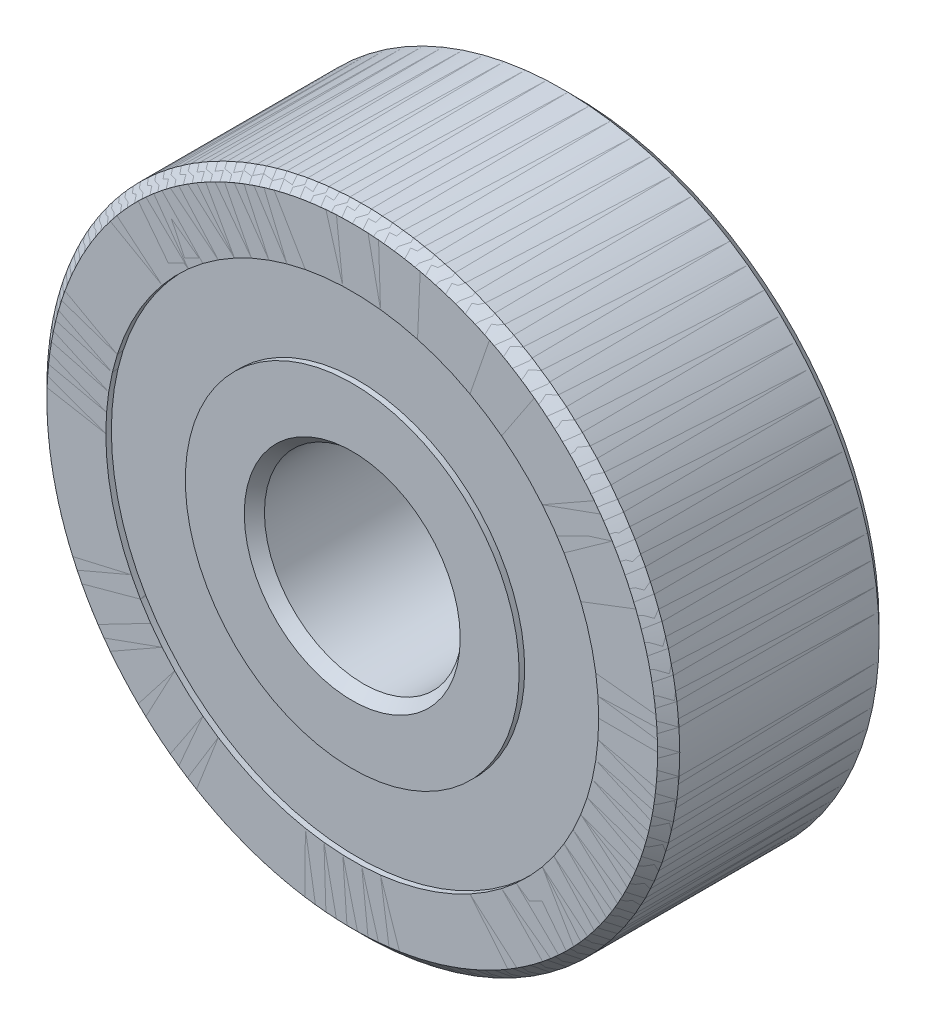
from build123d import *

# Parameters (mm, degrees)
CHAMFER1_SIZE     = 0.14
CIRPATTERN1_COUNT = 7
SKETCH5_W         = 0.705
SKETCH5_H         = 1.005


with BuildPart() as part:
    # Sketch8 → Revolve1 (revolve)
    with BuildSketch(Plane(origin=(0, 0, 0), x_dir=(0, 0, -1), z_dir=(1, 0, 0))):
        with BuildLine():
            Line((1.4, 4), (-1.4, 4))
            Line((-1.4, 4), (-1.4, 3.115))
            Line((-1.4, 3.115), (-0.37164331, 3.115))
            ThreePointArc((-0.37164331, 3.115), (0, 3.2375), (0.37164331, 3.115))
            Line((0.37164331, 3.115), (1.4, 3.115))
            Line((1.4, 3.115), (1.4, 4))
        make_face()
    revolve(axis=Axis((0, 0, 1.4), (0, 0, -1)))

    # Chamfer1
    chamfer1_edges = [part.edges().sort_by_distance(p)[0] for p in [
        (0, -4, -1.4),
        (0, -4, 1.4),
    ]]
    chamfer(chamfer1_edges, length=CHAMFER1_SIZE)


with BuildPart() as body_2:
    # Sketch2 → Revolve2 (revolve)
    with BuildSketch(Plane(origin=(0, 0, 0), x_dir=(0, 0, -1), z_dir=(1, 0, 0))):
        with BuildLine():
            Line((-0.37164331, 3.115), (-1.4, 3.115))
            Line((-1.4, 3.115), (-1.4, 3.86))
            Line((-1.4, 3.86), (-1.26, 4))
            Line((-1.26, 4), (1.26, 4))
            Line((1.26, 4), (1.4, 3.86))
            Line((1.4, 3.86), (1.4, 3.115))
            Line((1.4, 3.115), (0.37164331, 3.115))
            ThreePointArc((0.37164331, 3.115), (0, 3.2375), (-0.37164331, 3.115))
        make_face()
        with BuildLine():
            Line((1.4, 2.11), (0.37164331, 2.11))
            ThreePointArc((0.37164331, 2.11), (0, 1.9875), (-0.37164331, 2.11))
            Line((-0.37164331, 2.11), (-1.4, 2.11))
            Line((-1.4, 2.11), (-1.4, 1.365))
            Line((-1.4, 1.365), (-1.26, 1.25))
            Line((-1.26, 1.25), (1.26, 1.25))
            Line((1.26, 1.25), (1.4, 1.365))
            Line((1.4, 1.365), (1.4, 2.11))
        make_face()
    revolve(axis=Axis((0, 0, 1.4), (0, 0, -1)))


with BuildPart() as body_3:
    # Sketch3 → Revolve3 (revolve)
    with BuildSketch(Plane(origin=(0, 0, 0), x_dir=(0, 0, -1), z_dir=(1, 0, 0))):
        with BuildLine():
            Line((-0.625, 2.6125), (0.625, 2.6125))
            ThreePointArc((0.625, 2.6125), (0, 3.2375), (-0.625, 2.6125))
        make_face()
    revolve(axis=Axis((0, 2.6125, 0.625), (0, 0, -1)))


with BuildPart() as cirpattern1_1:
    # CirPattern1: pattern copy
    add(body_3.part.rotate(Axis((0, 0, -1.4), (0, 0, 1)), 1 * 360 / CIRPATTERN1_COUNT))


with BuildPart() as cirpattern1_2:
    # CirPattern1: pattern copy
    add(body_3.part.rotate(Axis((0, 0, -1.4), (0, 0, 1)), 2 * 360 / CIRPATTERN1_COUNT))


with BuildPart() as cirpattern1_3:
    # CirPattern1: pattern copy
    add(body_3.part.rotate(Axis((0, 0, -1.4), (0, 0, 1)), 3 * 360 / CIRPATTERN1_COUNT))


with BuildPart() as cirpattern1_4:
    # CirPattern1: pattern copy
    add(body_3.part.rotate(Axis((0, 0, -1.4), (0, 0, 1)), 4 * 360 / CIRPATTERN1_COUNT))


with BuildPart() as cirpattern1_5:
    # CirPattern1: pattern copy
    add(body_3.part.rotate(Axis((0, 0, -1.4), (0, 0, 1)), 5 * 360 / CIRPATTERN1_COUNT))


with BuildPart() as cirpattern1_6:
    # CirPattern1: pattern copy
    add(body_3.part.rotate(Axis((0, 0, -1.4), (0, 0, 1)), 6 * 360 / CIRPATTERN1_COUNT))


with BuildPart() as body_10:
    # Sketch5 → Revolve5 (revolve)
    with BuildSketch(Plane(origin=(0, 0, 0), x_dir=(0, 0, -1), z_dir=(1, 0, 0))):
        with Locations((-0.9775, 2.6125)):
            Rectangle(SKETCH5_W, SKETCH5_H)
        with Locations((0.9775, 2.6125)):
            Rectangle(SKETCH5_W, SKETCH5_H)
    revolve(axis=Axis((0, 0, 1.4), (0, 0, -1)))


solid = Compound([part.part, body_2.part, body_3.part, cirpattern1_1.part, cirpattern1_2.part, cirpattern1_3.part, cirpattern1_4.part, cirpattern1_5.part, cirpattern1_6.part, body_10.part])
